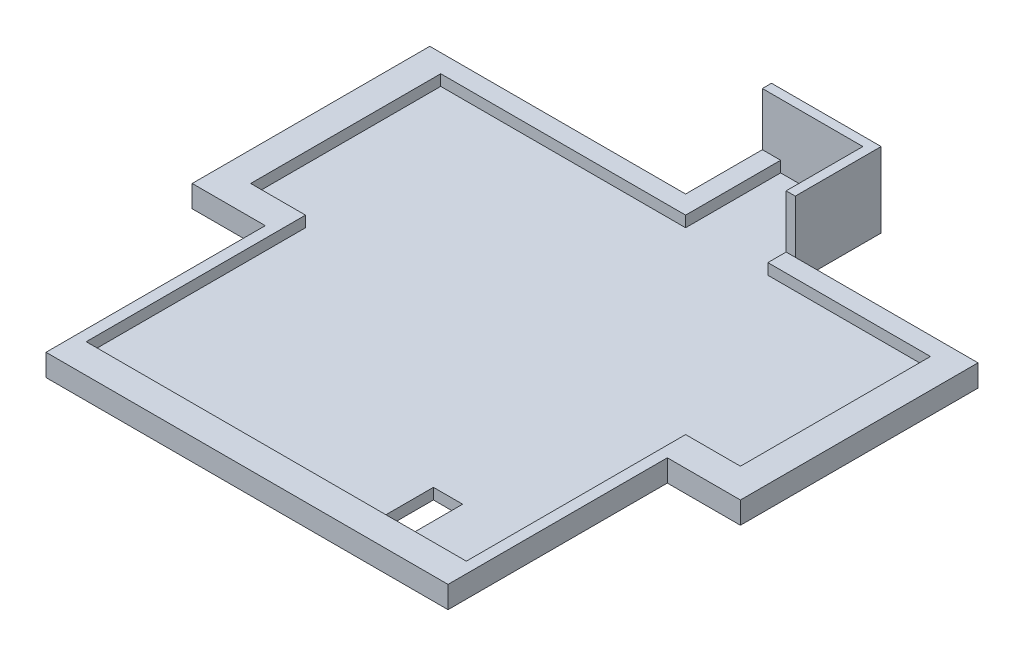
from build123d import *

# Parameters (mm, degrees)
CROQUIS1_W              = 150
CROQUIS1_H              = 148.5
SALIENTE_EXTRUIR1_DEPTH = 6
CROQUIS2_W              = 50
CROQUIS2_H              = 23.5
CROQUIS2_W_2            = 70
CROQUIS2_W_3            = 20
CROQUIS2_H_2            = 60
CORTAR_EXTRUIR2_DEPTH   = 8
CORTAR_EXTRUIR3_DEPTH   = 3
CROQUIS4_W              = 134
CROQUIS4_H              = 3
CROQUIS4_W_2            = 5
CROQUIS4_H_2            = 60
CROQUIS4_W_3            = 22.5
CROQUIS4_H_3            = 5.5
CORTAR_EXTRUIR4_DEPTH   = 3
CROQUIS5_W              = 3
CROQUIS5_H              = 20.5
CROQUIS5_W_2            = 5.5
CORTAR_EXTRUIR5_DEPTH   = 3
SALIENTE_EXTRUIR3_DEPTH = 14.5
CROQUIS8_W              = 6
CROQUIS8_H              = 13
CROQUIS8_W_2            = 13
CROQUIS8_H_2            = 6
CORTAR_EXTRUIR6_DEPTH   = 3
CROQUIS9_W              = 8
CROQUIS9_H              = 16
CORTAR_EXTRUIR7_DEPTH   = 107.978093552
SALIENTE_EXTRUIR4_DEPTH = 1


with BuildPart() as part:
    # Croquis1 → Saliente-Extruir1 (new body)
    with BuildSketch(Plane(origin=(0, 0, 0), x_dir=(1, 0, 0), z_dir=(0, 1, 0))):
        Rectangle(CROQUIS1_W, CROQUIS1_H)
    extrude(amount=SALIENTE_EXTRUIR1_DEPTH)

    # Croquis2 → Cortar-Extruir2 (cut)
    with BuildSketch(Plane(origin=(0, 6, 0), x_dir=(1, 0, 0), z_dir=(0, 1, 0))):
        with Locations((50, 62.5)):
            Rectangle(CROQUIS2_W, CROQUIS2_H)
        with Locations((-40, 62.5)):
            Rectangle(CROQUIS2_W_2, CROQUIS2_H)
        with Locations((-65, -44.25)):
            Rectangle(CROQUIS2_W_3, CROQUIS2_H_2)
        with Locations((65, -44.25)):
            Rectangle(CROQUIS2_W_3, CROQUIS2_H_2)
    extrude(amount=-CORTAR_EXTRUIR2_DEPTH, mode=Mode.SUBTRACT)

    # Croquis3 → Cortar-Extruir3 (cut)
    with BuildSketch(Plane(origin=(0, 6, 0), x_dir=(1, 0, 0), z_dir=(0, 1, 0))):
        Polygon((47, -6.25), (67, -6.25), (67, 42.75), (17, 42.75), (17, 66.25), (3, 66.25), (3, 42.75), (-67, 42.75), (-67, -6.25), (-47, -6.25), (-47, -66.25), (47, -66.25), align=None)
    extrude(amount=-CORTAR_EXTRUIR3_DEPTH, mode=Mode.SUBTRACT)

    # Croquis4 → Cortar-Extruir4 (cut)
    with BuildSketch(Plane(origin=(0, 6, 0), x_dir=(1, 0, 0), z_dir=(0, 1, 0))):
        with Locations((0, 44.25)):
            Rectangle(CROQUIS4_W, CROQUIS4_H)
        with Locations((-49.5, -36.25)):
            Rectangle(CROQUIS4_W_2, CROQUIS4_H_2)
        with Locations((49.5, -36.25)):
            Rectangle(CROQUIS4_W_2, CROQUIS4_H_2)
        with Locations((11.25, 69)):
            Rectangle(CROQUIS4_W_3, CROQUIS4_H_3)
    extrude(amount=-CORTAR_EXTRUIR4_DEPTH, mode=Mode.SUBTRACT)

    # Croquis5 → Cortar-Extruir5 (cut)
    with BuildSketch(Plane(origin=(0, 6, 0), x_dir=(1, 0, 0), z_dir=(0, 1, 0))):
        with Locations((1.5, 56)):
            Rectangle(CROQUIS5_W, CROQUIS5_H)
        with Locations((19.75, 56)):
            Rectangle(CROQUIS5_W_2, CROQUIS5_H)
    extrude(amount=-CORTAR_EXTRUIR5_DEPTH, mode=Mode.SUBTRACT)

    # Croquis7 → Saliente-Extruir3 (add)
    with BuildSketch(Plane(origin=(0, 6, 0), x_dir=(1, 0, 0), z_dir=(0, 1, 0))):
        Polygon((25, 50.75), (25, 74.25), (-5, 74.25), (-5, 71.75), (22.5, 71.75), (22.5, 50.75), align=None)
    extrude(amount=SALIENTE_EXTRUIR3_DEPTH)

    # Croquis8 → Cortar-Extruir6 (cut)
    with BuildSketch(Plane(origin=(0, 6, 0), x_dir=(1, 0, 0), z_dir=(0, 1, 0))):
        with Locations((-71, 18.25)):
            Rectangle(CROQUIS8_W, CROQUIS8_H)
        with Locations((71, 18.25)):
            Rectangle(CROQUIS8_W, CROQUIS8_H)
        with Locations((0, -70.25)):
            Rectangle(CROQUIS8_W_2, CROQUIS8_H_2)
    extrude(amount=-CORTAR_EXTRUIR6_DEPTH, mode=Mode.SUBTRACT)

    # Croquis9 → Cortar-Extruir7 (cut, through all)
    with BuildSketch(Plane(origin=(0, 3, 0), x_dir=(1, 0, 0), z_dir=(0, 1, 0))):
        with Locations((31, -58.25)):
            Rectangle(CROQUIS9_W, CROQUIS9_H)
    extrude(amount=-CORTAR_EXTRUIR7_DEPTH, mode=Mode.SUBTRACT)

    # Croquis10 → Saliente-Extruir4 (add)
    with BuildSketch(Plane(origin=(0, 6, 0), x_dir=(1, 0, 0), z_dir=(0, 1, 0))):
        Polygon((25, 50.75), (22.5, 50.75), (22.5, 45.75), (67, 45.75), (67, -6.25), (52, -6.25), (52, -66.25), (-52, -66.25), (-52, -6.25), (-67, -6.25), (-67, 45.75), (0, 45.75), (0, 71.75), (-5, 71.75), (-5, 50.75), (-75, 50.75), (-75, -14.25), (-55, -14.25), (-55, -74.25), (55, -74.25), (55, -14.25), (75, -14.25), (75, 50.75), align=None)
    extrude(amount=-SALIENTE_EXTRUIR4_DEPTH)


solid = part.part
